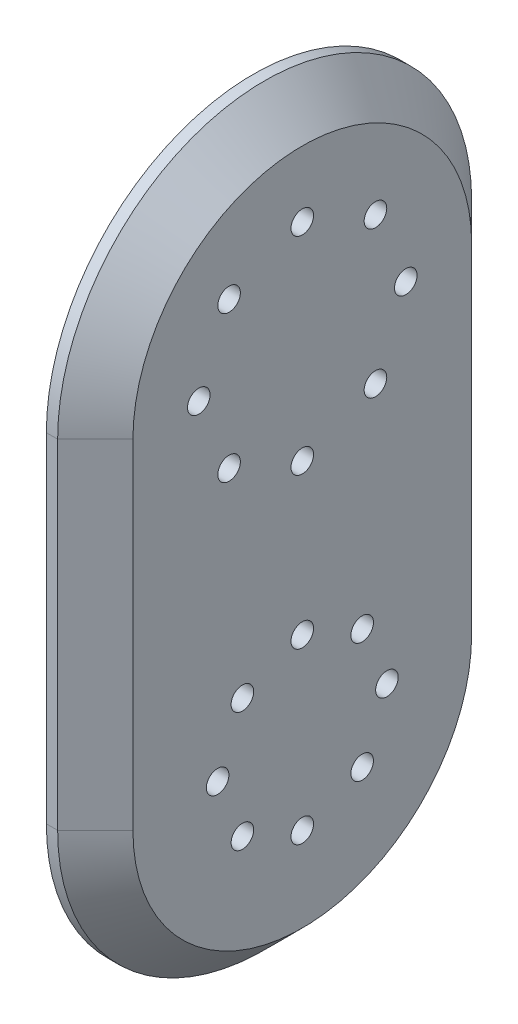
from build123d import *

# Parameters (mm, degrees)
EXTRUDE_1_DEPTH     = 13
CHAMFER_1_SIZE      = 10
SKETCH_2_R          = 23.5
CUT_EXTRUDE_1_DEPTH = 10
CUT_EXTRUDE_2_REACH = 116.865
SKETCH_3_R          = 3
CUT_EXTRUDE_3_DEPTH = 7
SKETCH_5_R          = 3
CUT_EXTRUDE_4_DEPTH = 7


with BuildPart() as part:
    # 草图1 → 凸台-拉伸1 (new body)
    with BuildSketch(Plane(origin=(0, 0, 0), x_dir=(0, 0, -1), z_dir=(1, 0, 0))):
        with BuildLine():
            Line((-55, -45), (-55, 45))
            ThreePointArc((-55, 45), (0, 100), (55, 45))
            Line((55, 45), (55, -45))
            ThreePointArc((55, -45), (0, -100), (-55, -45))
        make_face()
    extrude(amount=EXTRUDE_1_DEPTH)

    # 倒角1
    chamfer_1_edges = [part.edges().sort_by_distance(p)[0] for p in [
        (13, 100, 0),
        (13, 0, 55),
        (13, -100, 0),
        (13, 0, -55),
    ]]
    chamfer(chamfer_1_edges, length=CHAMFER_1_SIZE)

    # 草图2 → 切除-拉伸1 (cut)
    with BuildSketch(Plane.ZY):
        with Locations((0, 45)):
            Circle(SKETCH_2_R)
    extrude(amount=-CUT_EXTRUDE_1_DEPTH, mode=Mode.SUBTRACT)

    # 草图3 → 切除-拉伸2 (cut, up to next)
    with BuildSketch(Plane.ZY, mode=Mode.PRIVATE) as cut_extrude_2_sk1:
        with Locations((0, 72.5)):
            Circle(SKETCH_3_R)
    cut_extrude_2_tool1 = extrude(cut_extrude_2_sk1.sketch, amount=-CUT_EXTRUDE_2_REACH, mode=Mode.PRIVATE) & part.part
    # 草图3 → 切除-拉伸2 (cut, up to next)
    with BuildSketch(Plane.ZY, mode=Mode.PRIVATE) as cut_extrude_2_sk2:
        with Locations((19.445436483, 64.445436483)):
            Circle(SKETCH_3_R)
    cut_extrude_2_tool2 = extrude(cut_extrude_2_sk2.sketch, amount=-CUT_EXTRUDE_2_REACH, mode=Mode.PRIVATE) & part.part
    # 草图3 → 切除-拉伸2 (cut, up to next)
    with BuildSketch(Plane.ZY, mode=Mode.PRIVATE) as cut_extrude_2_sk3:
        with Locations((27.5, 45)):
            Circle(SKETCH_3_R)
    cut_extrude_2_tool3 = extrude(cut_extrude_2_sk3.sketch, amount=-CUT_EXTRUDE_2_REACH, mode=Mode.PRIVATE) & part.part
    # 草图3 → 切除-拉伸2 (cut, up to next)
    with BuildSketch(Plane.ZY, mode=Mode.PRIVATE) as cut_extrude_2_sk4:
        with Locations((19.445436483, 25.554563517)):
            Circle(SKETCH_3_R)
    cut_extrude_2_tool4 = extrude(cut_extrude_2_sk4.sketch, amount=-CUT_EXTRUDE_2_REACH, mode=Mode.PRIVATE) & part.part
    # 草图3 → 切除-拉伸2 (cut, up to next)
    with BuildSketch(Plane.ZY, mode=Mode.PRIVATE) as cut_extrude_2_sk5:
        with Locations((0, 17.5)):
            Circle(SKETCH_3_R)
    cut_extrude_2_tool5 = extrude(cut_extrude_2_sk5.sketch, amount=-CUT_EXTRUDE_2_REACH, mode=Mode.PRIVATE) & part.part
    # 草图3 → 切除-拉伸2 (cut, up to next)
    with BuildSketch(Plane.ZY, mode=Mode.PRIVATE) as cut_extrude_2_sk6:
        with Locations((-19.445436483, 25.554563517)):
            Circle(SKETCH_3_R)
    cut_extrude_2_tool6 = extrude(cut_extrude_2_sk6.sketch, amount=-CUT_EXTRUDE_2_REACH, mode=Mode.PRIVATE) & part.part
    # 草图3 → 切除-拉伸2 (cut, up to next)
    with BuildSketch(Plane.ZY, mode=Mode.PRIVATE) as cut_extrude_2_sk7:
        with Locations((-27.5, 45)):
            Circle(SKETCH_3_R)
    cut_extrude_2_tool7 = extrude(cut_extrude_2_sk7.sketch, amount=-CUT_EXTRUDE_2_REACH, mode=Mode.PRIVATE) & part.part
    # 草图3 → 切除-拉伸2 (cut, up to next)
    with BuildSketch(Plane.ZY, mode=Mode.PRIVATE) as cut_extrude_2_sk8:
        with Locations((-19.445436483, 64.445436483)):
            Circle(SKETCH_3_R)
    cut_extrude_2_tool8 = extrude(cut_extrude_2_sk8.sketch, amount=-CUT_EXTRUDE_2_REACH, mode=Mode.PRIVATE) & part.part
    add(cut_extrude_2_tool1.solids().sort_by_distance((0, 72.5, 0))[0], mode=Mode.SUBTRACT)
    add(cut_extrude_2_tool2.solids().sort_by_distance((0, 64.445436, 19.445436))[0], mode=Mode.SUBTRACT)
    add(cut_extrude_2_tool3.solids().sort_by_distance((0, 45, 27.5))[0], mode=Mode.SUBTRACT)
    add(cut_extrude_2_tool4.solids().sort_by_distance((0, 25.554564, 19.445436))[0], mode=Mode.SUBTRACT)
    add(cut_extrude_2_tool5.solids().sort_by_distance((0, 17.5, 0))[0], mode=Mode.SUBTRACT)
    add(cut_extrude_2_tool6.solids().sort_by_distance((0, 25.554564, -19.445436))[0], mode=Mode.SUBTRACT)
    add(cut_extrude_2_tool7.solids().sort_by_distance((0, 45, -27.5))[0], mode=Mode.SUBTRACT)
    add(cut_extrude_2_tool8.solids().sort_by_distance((0, 64.445436, -19.445436))[0], mode=Mode.SUBTRACT)

    # 草图4 → 切除-拉伸3 (cut)
    with BuildSketch(Plane.ZY):
        with BuildLine():
            Line((-31, -45), (-31, -15))
            ThreePointArc((-31, -15), (-28.071067812, -7.928932188), (-21, -5))
            Line((-21, -5), (21, -5))
            ThreePointArc((21, -5), (28.071067812, -7.928932188), (31, -15))
            Line((31, -15), (31, -45))
            ThreePointArc((31, -45), (0, -76), (-31, -45))
        make_face()
    extrude(amount=-CUT_EXTRUDE_3_DEPTH, mode=Mode.SUBTRACT)

    # 草图5 → 切除-拉伸4 (cut)
    with BuildSketch(Plane.ZY.offset(-7)):
        with Locations((0, -22.5)):
            Circle(SKETCH_5_R)
        with Locations((15.909902577, -29.090097423)):
            Circle(SKETCH_5_R)
        with Locations((22.5, -45)):
            Circle(SKETCH_5_R)
        with Locations((15.909902577, -60.909902577)):
            Circle(SKETCH_5_R)
        with Locations((0, -67.5)):
            Circle(SKETCH_5_R)
        with Locations((-15.909902577, -60.909902577)):
            Circle(SKETCH_5_R)
        with Locations((-22.5, -45)):
            Circle(SKETCH_5_R)
        with Locations((-15.909902577, -29.090097423)):
            Circle(SKETCH_5_R)
    extrude(amount=-CUT_EXTRUDE_4_DEPTH, mode=Mode.SUBTRACT)


solid = part.part
